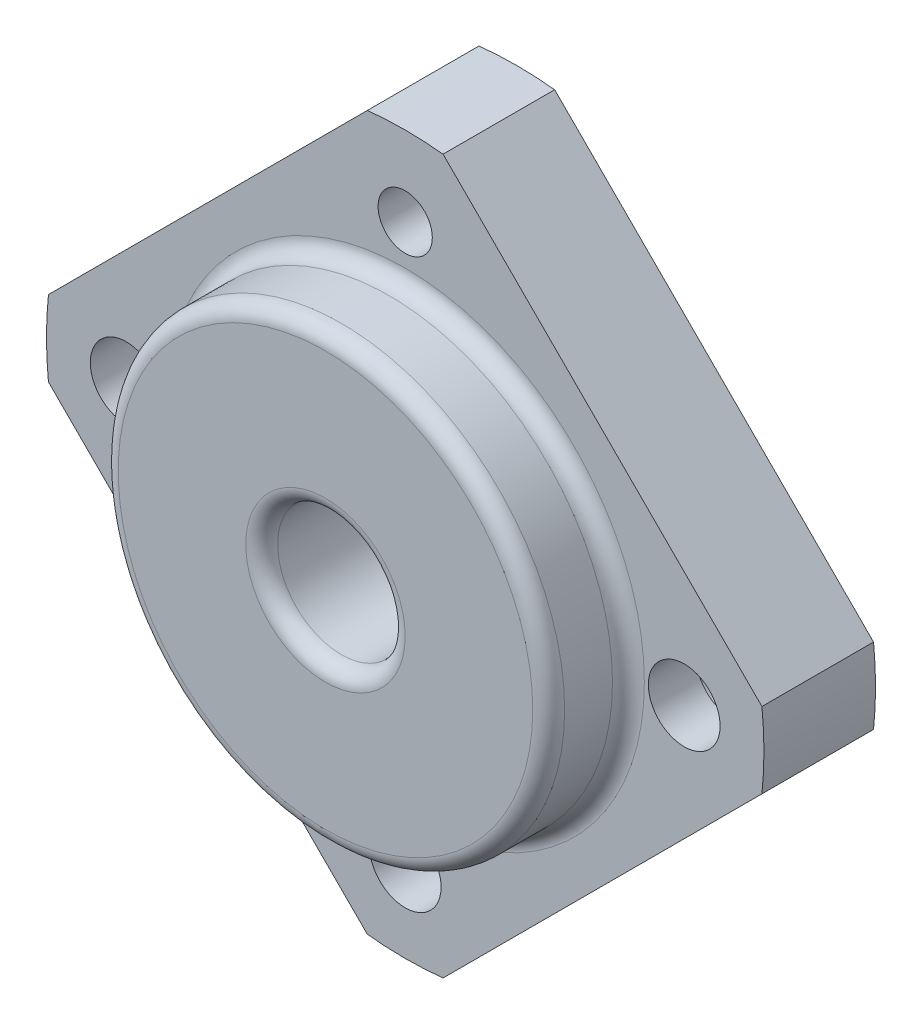
from build123d import *

# Parameters (mm, degrees)
BOSS_EXTRUDE1_DEPTH = 7
SKETCH2_R           = 3.25
CUT_EXTRUDE1_DEPTH  = 4
SKETCH3_R           = 1.7
SKETCH3_R_2         = 2.25
CUT_EXTRUDE2_DEPTH  = 4
SKETCH4_R           = 14
BOSS_EXTRUDE2_DEPTH = 5
SKETCH5_R           = 4
CUT_EXTRUDE3_DEPTH  = 15
FILLET3_R           = 1


with BuildPart() as part:
    # Sketch1 → Boss-Extrude1 (new body)
    with BuildSketch(Plane.XY):
        with BuildLine():
            Line((-12.374368671, -12.374368671), (-22.374368671, -2.374368671))
            ThreePointArc((-22.374368671, -2.374368671), (-22.5, 0), (-22.374368671, 2.374368671))
            Line((-22.374368671, 2.374368671), (-12.374368671, 12.374368671))
            Line((-12.374368671, 12.374368671), (-2.374368671, 22.374368671))
            ThreePointArc((-2.374368671, 22.374368671), (0, 22.5), (2.374368671, 22.374368671))
            Line((2.374368671, 22.374368671), (12.374368671, 12.374368671))
            Line((12.374368671, 12.374368671), (22.374368671, 2.374368671))
            ThreePointArc((22.374368671, 2.374368671), (22.5, 0), (22.374368671, -2.374368671))
            Line((22.374368671, -2.374368671), (12.374368671, -12.374368671))
            Line((12.374368671, -12.374368671), (2.374368671, -22.374368671))
            ThreePointArc((2.374368671, -22.374368671), (0, -22.5), (-2.374368671, -22.374368671))
            Line((-2.374368671, -22.374368671), (-12.374368671, -12.374368671))
        make_face()
    extrude(amount=BOSS_EXTRUDE1_DEPTH)

    # Sketch2 → Cut-Extrude1 (cut)
    with BuildSketch(Plane(origin=(0, 0, 0), x_dir=(-1, 0, 0), z_dir=(0, 0, -1))):
        with Locations((0, 17.5)):
            Circle(SKETCH2_R)
        with Locations((-17.5, 0)):
            Circle(SKETCH2_R)
        with Locations((0, -17.5)):
            Circle(SKETCH2_R)
        with Locations((17.5, 0)):
            Circle(SKETCH2_R)
    extrude(amount=-CUT_EXTRUDE1_DEPTH, mode=Mode.SUBTRACT)

    # Sketch3 → Cut-Extrude2 (cut)
    with BuildSketch(Plane(origin=(0, 0, 4), x_dir=(-1, 0, 0), z_dir=(0, 0, -1))):
        with Locations((0, 17.5)):
            Circle(SKETCH3_R)
        with Locations((-17.5, 0)):
            Circle(SKETCH3_R_2)
        with Locations((17.5, 0)):
            Circle(SKETCH3_R_2)
        with Locations((0, -17.5)):
            Circle(SKETCH3_R_2)
    extrude(amount=-CUT_EXTRUDE2_DEPTH, mode=Mode.SUBTRACT)

    # Sketch4 → Boss-Extrude2 (add)
    with BuildSketch(Plane.XY.offset(7)):
        Circle(SKETCH4_R)
    extrude(amount=BOSS_EXTRUDE2_DEPTH)

    # Sketch5 → Cut-Extrude3 (cut)
    with BuildSketch(Plane.XY.offset(12)):
        Circle(SKETCH5_R)
    extrude(amount=-CUT_EXTRUDE3_DEPTH, mode=Mode.SUBTRACT)

    # Fillet3
    fillet3_edges = [part.edges().sort_by_distance(p)[0] for p in [
        (-14, 0, 7),
        (-14, 0, 12),
        (-4, 0, 12),
    ]]
    fillet(fillet3_edges, radius=FILLET3_R)


solid = part.part
